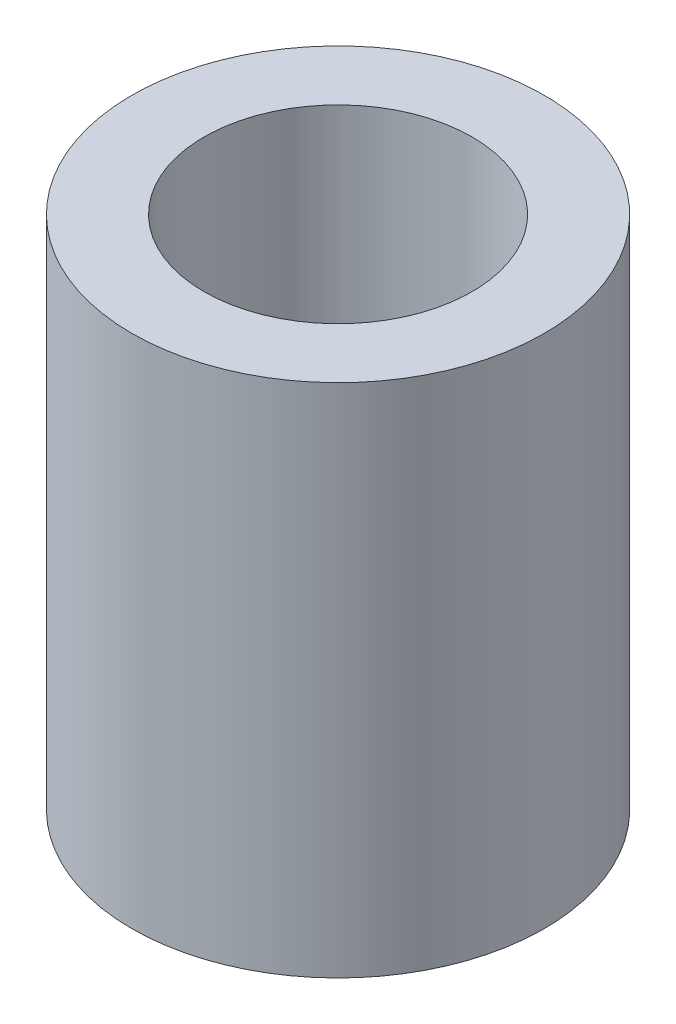
from build123d import *

# Parameters (mm, degrees)
SKETCH_1_R      = 4
SKETCH_1_R_2    = 2.6
EXTRUDE_1_DEPTH = 10


with BuildPart() as part:
    # 草图1 → 凸台-拉伸1 (new body)
    with BuildSketch(Plane(origin=(0, 0, 0), x_dir=(1, 0, 0), z_dir=(0, 1, 0))):
        with Locations(Location((0, 0, 0), (0, 0, 270))):
            Circle(SKETCH_1_R)
        with Locations(Location((0, 0, 0), (0, 0, 270))):
            Circle(SKETCH_1_R_2, mode=Mode.SUBTRACT)
    extrude(amount=EXTRUDE_1_DEPTH)


solid = part.part
